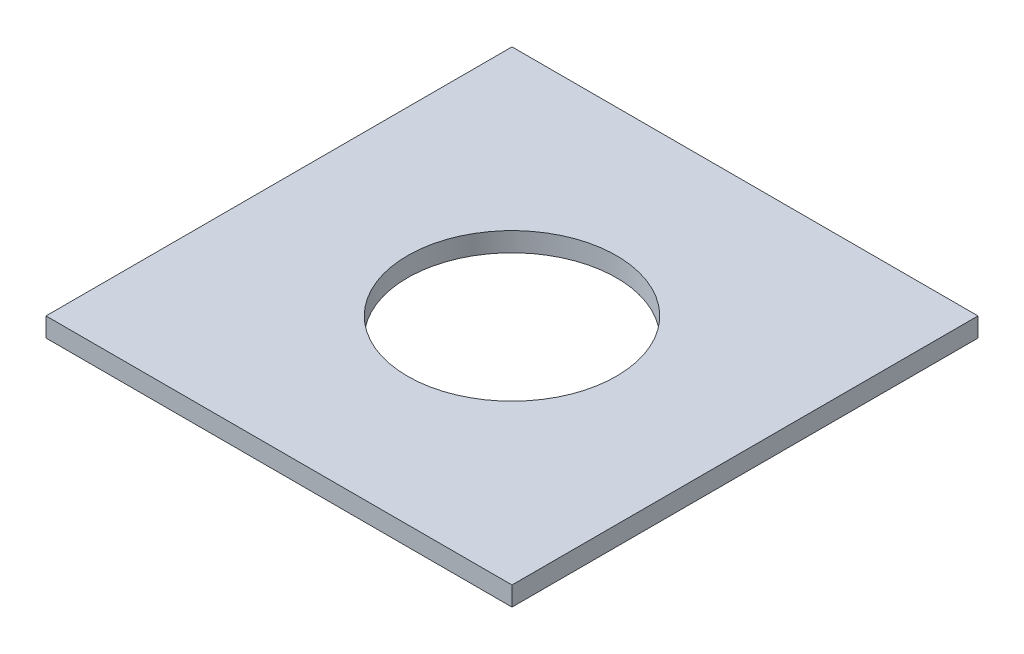
from build123d import *

# Parameters (mm, degrees)
SKETCH_1_W      = 194
SKETCH_1_H      = 194
SKETCH_1_R      = 43.5
EXTRUDE_1_DEPTH = 8


with BuildPart() as part:
    # 草图1 → 凸台-拉伸1 (new body)
    with BuildSketch(Plane(origin=(0, 0, 0), x_dir=(1, 0, 0), z_dir=(0, 1, 0))):
        with Locations((6.333333333, -32)):
            Rectangle(SKETCH_1_W, SKETCH_1_H)
        with Locations(Location((6.333333333, -32, 0), (0, 0, 270))):
            Circle(SKETCH_1_R, mode=Mode.SUBTRACT)
    extrude(amount=EXTRUDE_1_DEPTH)


solid = part.part
